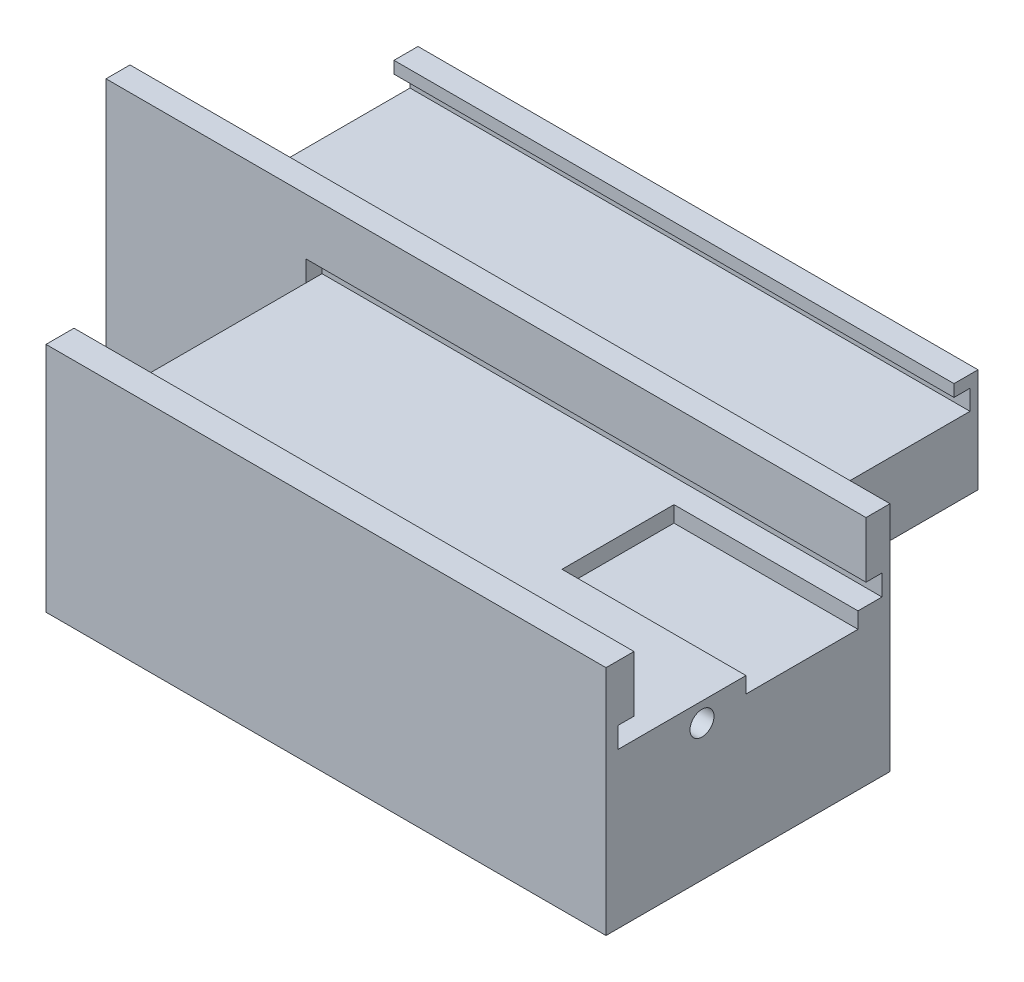
from build123d import *

# Parameters (mm, degrees)
BOSS_EXTRUDE1_DEPTH     = 94.99986
SKETCH2_W               = 23
SKETCH2_H               = 14
CUT_EXTRUDE1_DEPTH      = 2
CUT_EXTRUDE2_DEPTH      = 86.037208991
CUT_EXTRUDE2_DEPTH_BACK = 86.037208991
SKETCH4_W               = 25
SKETCH4_H               = 32.499936
SKETCH4_W_2             = 24.99986
SKETCH4_H_2             = 36
SKETCH5_W               = 25
SKETCH5_H               = 2.6
BOSS_EXTRUDE3_DEPTH     = 2
SKETCH6_W               = 24.99986
SKETCH6_H               = 2.5
BOSS_EXTRUDE4_DEPTH     = 2
SKETCH7_R               = 1.5
CUT_EXTRUDE3_DEPTH      = 10
SKETCH8_R               = 1.5
CUT_EXTRUDE4_DEPTH      = 10


with BuildPart() as part:
    # Sketch1 → Boss-Extrude1 (new body)
    with BuildSketch(Plane.ZY.offset(29.759563114)):
        Polygon((-16.355611523, -2.282836071), (-18.355611523, -2.282836071), (-18.355611523, -4.782836071), (18.644388477, -4.782836071), (18.644388477, -2.282836071), (16.644388477, -2.282836071), (16.644388477, 15.217163929), (19.644388477, 15.217163929), (19.644388477, 8.217163929), (17.644388477, 8.217163929), (17.644388477, 5.617163929), (50.644324477, 5.617163929), (50.644324477, 8.217163929), (48.644324477, 8.217163929), (48.644324477, 15.217163929), (52.144324477, 15.217163929), (52.144324477, -13.782836071), (-19.355611523, -13.782836071), (-19.355611523, -0.782836071), (-16.355611523, -0.782836071), align=None)
    extrude(amount=-BOSS_EXTRUDE1_DEPTH)

    # Sketch2 → Cut-Extrude1 (cut)
    with BuildSketch(Plane(origin=(0, 5.617163929, 0), x_dir=(1, 0, 0), z_dir=(0, 1, 0))):
        with Locations((53.740296886, -27.644388477)):
            Rectangle(SKETCH2_W, SKETCH2_H)
    extrude(amount=-CUT_EXTRUDE1_DEPTH, mode=Mode.SUBTRACT)

    # Sketch4 → Cut-Extrude2 (cut, two sides: drawn at the far end of the back side and taken through both)
    with BuildSketch(Plane(origin=(0, -0.782836071, 0), x_dir=(1, 0, 0), z_dir=(0, 1, 0)).offset(-CUT_EXTRUDE2_DEPTH_BACK)):
        with Locations((-17.259563114, -35.894356477)):
            Rectangle(SKETCH4_W, SKETCH4_H)
        with Locations((52.740366886, 1.355611523)):
            Rectangle(SKETCH4_W_2, SKETCH4_H_2)
    extrude(amount=CUT_EXTRUDE2_DEPTH + CUT_EXTRUDE2_DEPTH_BACK, mode=Mode.SUBTRACT)

    # Sketch5 → Boss-Extrude3 (add)
    with BuildSketch(Plane.XY.offset(19.644388477)):
        with Locations((-17.259563114, 6.917163929)):
            Rectangle(SKETCH5_W, SKETCH5_H)
    extrude(amount=-BOSS_EXTRUDE3_DEPTH)

    # Sketch6 → Boss-Extrude4 (add)
    with BuildSketch(Plane(origin=(0, 0, 16.644388477), x_dir=(-1, 0, 0), z_dir=(0, 0, -1))):
        with Locations((-52.740366886, -3.532836071)):
            Rectangle(SKETCH6_W, SKETCH6_H)
    extrude(amount=-BOSS_EXTRUDE4_DEPTH)

    # Sketch7 → Cut-Extrude3 (cut)
    with BuildSketch(Plane(origin=(65.240296886, 0, 0), x_dir=(0, 0, -1), z_dir=(1, 0, 0))):
        with Locations((-40.144324477, 3.217163929)):
            Circle(SKETCH7_R)
    extrude(amount=-CUT_EXTRUDE3_DEPTH, mode=Mode.SUBTRACT)

    # Sketch8 → Cut-Extrude4 (cut)
    with BuildSketch(Plane.ZY.offset(29.759563114)):
        with Locations((-1.355611523, -7.182836071)):
            Circle(SKETCH8_R)
    extrude(amount=-CUT_EXTRUDE4_DEPTH, mode=Mode.SUBTRACT)


solid = part.part
